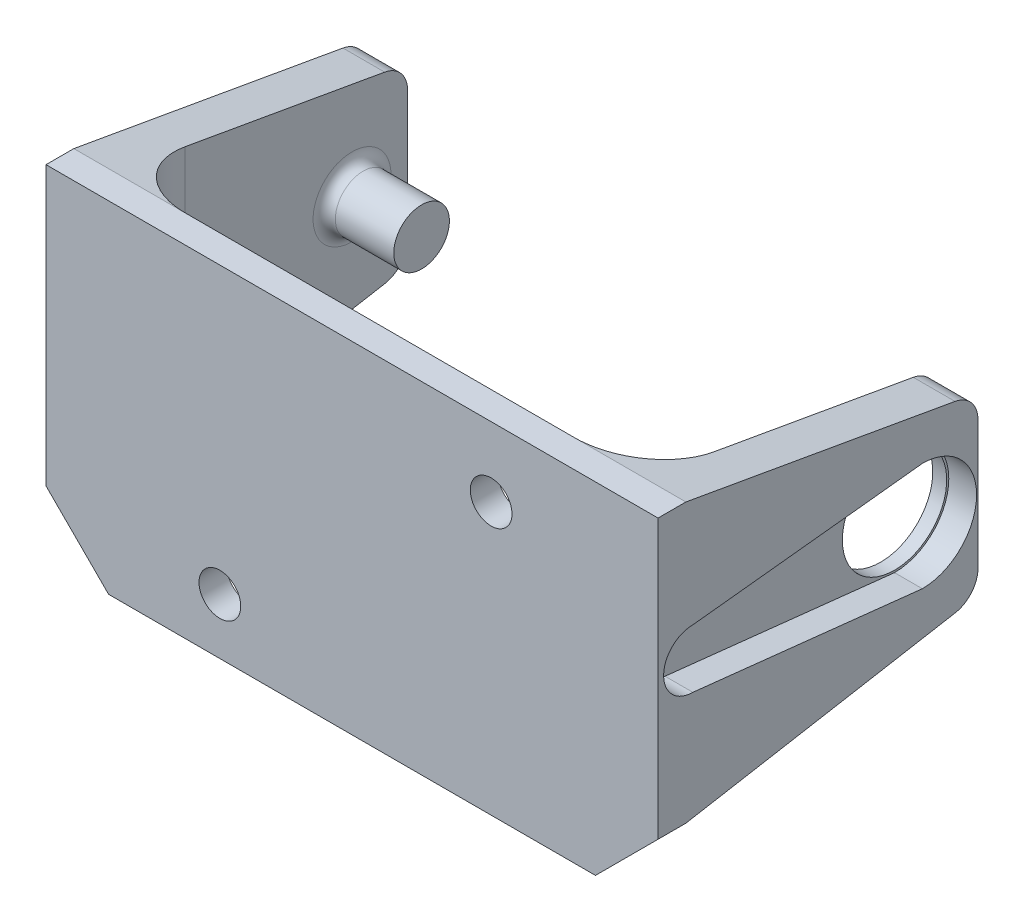
from build123d import *

# Parameters (mm, degrees)
SKETCH1_W           = 38
SKETCH1_H           = 20
BOSS_EXTRUDE1_DEPTH = 2
BOSS_EXTRUDE2_DEPTH = 3
BOSS_EXTRUDE3_DEPTH = 2
SKETCH4_R           = 1.3
CUT_EXTRUDE1_DEPTH  = 51.865017448
CUT_EXTRUDE2_START  = -1
CUT_EXTRUDE2_DEPTH  = 2
SKETCH6_R           = 3.75
CUT_EXTRUDE3_DEPTH  = 2.4
SKETCH7_W           = 44
SKETCH7_H           = 6
CUT_EXTRUDE4_DEPTH  = 34.693471178
SKETCH8_R           = 2
BOSS_EXTRUDE4_DEPTH = 8
FILLET1_R           = 0.8
FILLET2_R           = 5
SKETCH9_R           = 1.5
CUT_EXTRUDE5_DEPTH  = 10


with BuildPart() as part:
    # Sketch1 → Boss-Extrude1 (new body)
    with BuildSketch(Plane.XY):
        Rectangle(SKETCH1_W, SKETCH1_H)
    extrude(amount=BOSS_EXTRUDE1_DEPTH)

    # Sketch2 → Boss-Extrude2 (add)
    with BuildSketch(Plane(origin=(19, 0, 0), x_dir=(0, 0, -1), z_dir=(1, 0, 0))):
        with BuildLine():
            Line((-2, 10), (0, 10))
            Line((0, 10), (19.347296355, 6.588549649))
            ThreePointArc((19.347296355, 6.588549649), (20.532088886, 5.904509362), (21, 4.618934143))
            Line((21, 4.618934143), (21, -4.618934143))
            ThreePointArc((21, -4.618934143), (20.532088886, -5.904509362), (19.347296355, -6.588549649))
            Line((19.347296355, -6.588549649), (0, -10))
            Line((0, -10), (-2, -10))
            Line((-2, -10), (-2, 10))
        make_face()
    boss_extrude2 = extrude(amount=BOSS_EXTRUDE2_DEPTH)

    # Mirror1: Boss-Extrude2 across plane
    add(boss_extrude2.mirror(Plane(origin=(0, 0, 0), x_dir=(0, 0, 1), z_dir=(1, 0, 0))))

    # Sketch3 → Boss-Extrude3 (add)
    with BuildSketch(Plane(origin=(0, 0, 0), x_dir=(-1, 0, 0), z_dir=(0, 0, -1))):
        Polygon((-22, -10), (-17.5, -14.5), (17.5, -14.5), (22, -10), align=None)
        Polygon((-22, 10), (22, 10), (17.5, 14.5), (-17.5, 14.5), align=None)
    extrude(amount=-BOSS_EXTRUDE3_DEPTH)

    # Sketch4 → Cut-Extrude1 (cut, through all)
    with BuildSketch(Plane.ZY.offset(22)):
        with Locations((-17, 0)):
            Circle(SKETCH4_R)
    extrude(amount=-CUT_EXTRUDE1_DEPTH, mode=Mode.SUBTRACT)

    # Sketch5 → Cut-Extrude2 (cut)
    with BuildSketch(Plane.ZY.offset(-19).offset(CUT_EXTRUDE2_START)):
        with BuildLine():
            Line((-0.5, -2.1), (-17, -3.9))
            ThreePointArc((-17, -3.9), (-20.9, 0), (-17, 3.9))
            Line((-17, 3.9), (-0.5, 2.1))
            ThreePointArc((-0.5, 2.1), (1.6, 0), (-0.5, -2.1))
        make_face()
    extrude(amount=-CUT_EXTRUDE2_DEPTH, mode=Mode.SUBTRACT)

    # Sketch6 → Cut-Extrude3 (cut)
    with BuildSketch(Plane.ZY.offset(-19)):
        with Locations((-17, 0)):
            Circle(SKETCH6_R)
    extrude(amount=-CUT_EXTRUDE3_DEPTH, mode=Mode.SUBTRACT)

    # Sketch7 → Cut-Extrude4 (cut, through all)
    with BuildSketch(Plane(origin=(0, 0, 0), x_dir=(-1, 0, 0), z_dir=(0, 0, -1))):
        with Locations((0, 13)):
            Rectangle(SKETCH7_W, SKETCH7_H)
    extrude(amount=-CUT_EXTRUDE4_DEPTH, mode=Mode.SUBTRACT)

    # Sketch8 → Boss-Extrude4 (add)
    with BuildSketch(Plane.ZY.offset(22)):
        with Locations((-17, 0)):
            Circle(SKETCH8_R)
    extrude(amount=-BOSS_EXTRUDE4_DEPTH)

    # Fillet1
    fillet1_edges = [part.edges().sort_by_distance(p)[0] for p in [
        (-19, 0, -19),
    ]]
    fillet(fillet1_edges, radius=FILLET1_R)

    # Fillet2
    fillet2_edges = [part.edges().sort_by_distance(p)[0] for p in [
        (-19, 0, 0),
        (19, 0, 0),
    ]]
    fillet(fillet2_edges, radius=FILLET2_R)

    # Sketch9 → Cut-Extrude5 (cut)
    with BuildSketch(Plane(origin=(0, 0, 0), x_dir=(-1, 0, 0), z_dir=(0, 0, -1))):
        with Locations((-10, 5)):
            Circle(SKETCH9_R)
        with Locations((9.5, -10.5)):
            Circle(SKETCH9_R)
    extrude(amount=-CUT_EXTRUDE5_DEPTH, mode=Mode.SUBTRACT)


solid = part.part
